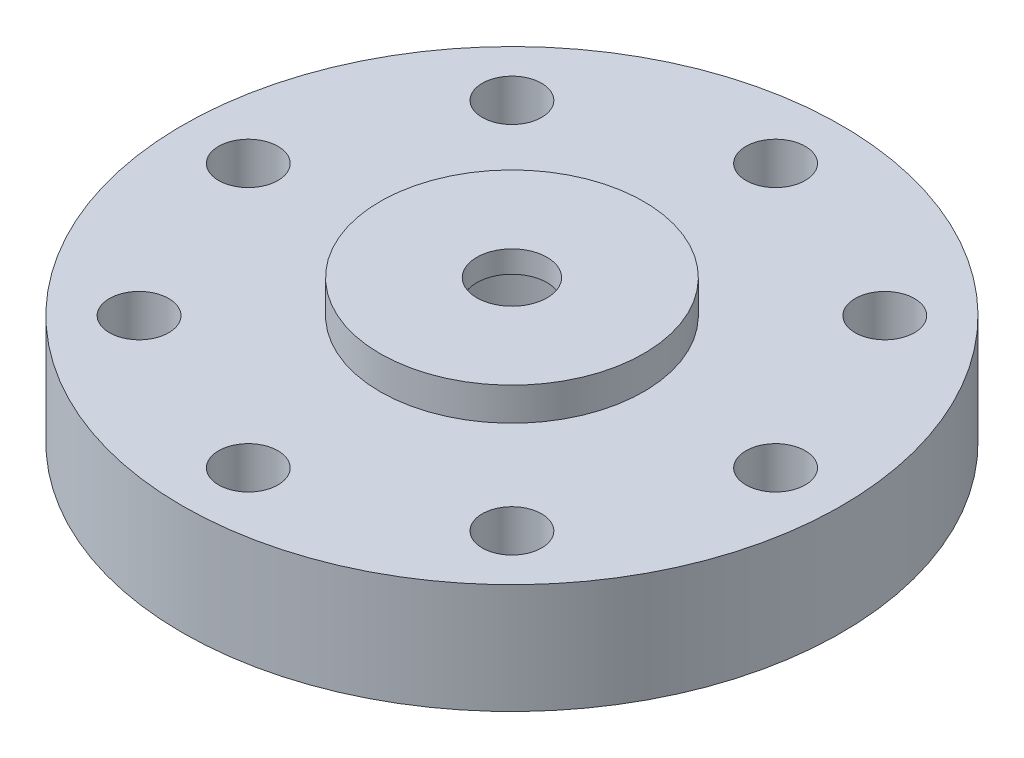
from build123d import *

# Parameters (mm, degrees)
ESQUISSE1_R             = 15
BOSS_EXTRU_1_DEPTH      = 5
ESQUISSE2_R             = 6
BOSS_EXTRU_2_DEPTH      = 1.5
ESQUISSE3_R             = 1.6
ENL_V_MAT_EXTRU_1_DEPTH = 23.186707732
ESQUISSE4_R             = 3.7
ENL_V_MAT_EXTRU_2_DEPTH = 5.5
D_GAGEMENT_M2_51_D      = 2.7


with BuildPart() as part:
    # Esquisse1 → Boss.-Extru.1 (new body)
    with BuildSketch(Plane(origin=(0, 0, 0), x_dir=(1, 0, 0), z_dir=(0, 1, 0))):
        with Locations(Location((0, 0, 0), (0, 0, 270))):
            Circle(ESQUISSE1_R)
    extrude(amount=BOSS_EXTRU_1_DEPTH)

    # Esquisse2 → Boss.-Extru.2 (add)
    with BuildSketch(Plane(origin=(0, 5, 0), x_dir=(1, 0, 0), z_dir=(0, 1, 0))):
        with Locations(Location((0, 0, 0), (0, 0, 270))):
            Circle(ESQUISSE2_R)
    extrude(amount=BOSS_EXTRU_2_DEPTH)

    # Esquisse3 → Enlèv. mat.-Extru.1 (cut, through all)
    with BuildSketch(Plane.XZ):
        with Locations(Location((0, 0, 0), (0, 0, 270))):
            Circle(ESQUISSE3_R)
    extrude(amount=-ENL_V_MAT_EXTRU_1_DEPTH, mode=Mode.SUBTRACT)

    # Esquisse4 → Enlèv. mat.-Extru.2 (cut)
    with BuildSketch(Plane.XZ):
        with Locations(Location((0, 0, 0), (0, 0, 270))):
            Circle(ESQUISSE4_R)
    extrude(amount=-ENL_V_MAT_EXTRU_2_DEPTH, mode=Mode.SUBTRACT)

    # Dégagement M2.51 (through all)
    with Locations(Plane(origin=(0, 5, 0), x_dir=(1, 0, 0), z_dir=(0, 1, 0))):
        with Locations((0, 0), (-12, 0), (-8.485281374, 8.485281374), (0, 12), (8.485281374, 8.485281374), (12, 0), (8.485281374, -8.485281374), (0, -12), (-8.485281374, -8.485281374)):
            Hole(D_GAGEMENT_M2_51_D / 2)


solid = part.part
